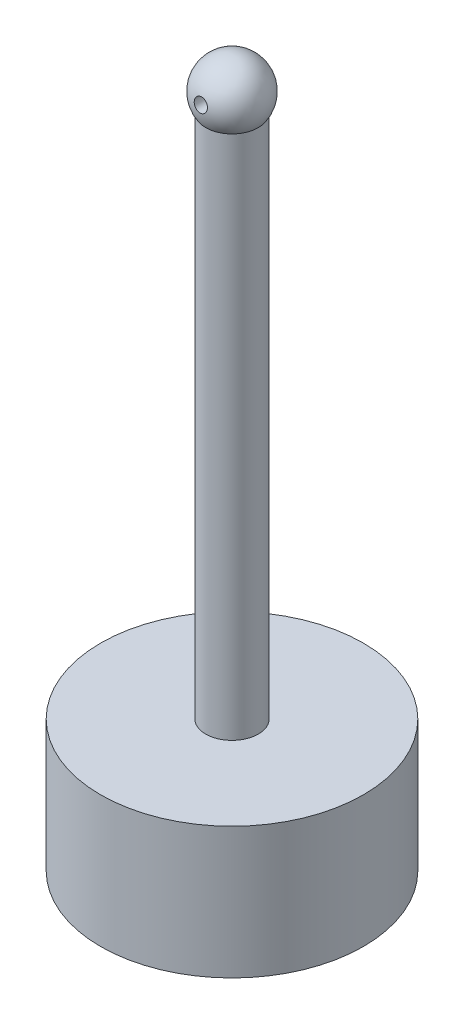
from build123d import *
from build123d.topology import SkipClean

# Parameters (mm, degrees)
SKETCH1_R               = 500
BOSS_EXTRUDE1_DEPTH     = 500
SKETCH2_R               = 100
BOSS_EXTRUDE2_DEPTH     = 2000
CUT_EXTRUDE1_DEPTH      = 164
CUT_EXTRUDE1_DEPTH_BACK = 147
SKETCH5_R               = 25


with BuildPart() as part:
    # Sketch1 → Boss-Extrude1 (new body)
    with BuildSketch(Plane(origin=(0, 0, 0), x_dir=(1, 0, 0), z_dir=(0, 1, 0))):
        with Locations(Location((0, 0, 0), (0, 0, 270))):
            Circle(SKETCH1_R)
    extrude(amount=BOSS_EXTRUDE1_DEPTH)

    # Sketch2 → Boss-Extrude2 (add)
    with BuildSketch(Plane(origin=(0, 500, 0), x_dir=(1, 0, 0), z_dir=(0, 1, 0))):
        with Locations(Location((0, 0, 0), (0, 0, 270))):
            Circle(SKETCH2_R)
    extrude(amount=BOSS_EXTRUDE2_DEPTH)

    # Sketch4 → Revolve3 (revolve)
    with SkipClean():  # the faces are left unmerged after this step: merging them gives an invalid solid
        with BuildSketch(Plane.XY, mode=Mode.PRIVATE) as revolve3_sk:
            with BuildLine():
                ThreePointArc((122.029891086, 2568.171222464), (86.288163494, 2654.459385958), (0, 2690.20111355))
                Line((0, 2690.20111355), (0, 2446.141331378))
                ThreePointArc((0, 2446.141331378), (86.288163494, 2481.883058969), (122.029891086, 2568.171222464))
            make_face()
            with BuildLine():
                Line((0, 2446.141331378), (0, 2690.20111355))
                ThreePointArc((0, 2690.20111355), (-122.029891086, 2568.171222464), (0, 2446.141331378))
            make_face()
        revolve(revolve3_sk.sketch.rotate(Axis((0, 2690.20111355, 0), (0, -1, 0)), 90), axis=Axis((0, 2690.20111355, 0), (0, -1, 0)))

    # Sketch5 → Cut-Extrude1 (cut, two sides: drawn at the far end of the back side and taken through both)
    with BuildSketch(Plane.XY.offset(-CUT_EXTRUDE1_DEPTH_BACK)):
        with Locations(Location((0, 2582.524351177, 0), (0, 0, 223.802603959))):
            Circle(SKETCH5_R)
    extrude(amount=CUT_EXTRUDE1_DEPTH + CUT_EXTRUDE1_DEPTH_BACK, mode=Mode.SUBTRACT)


solid = part.part
